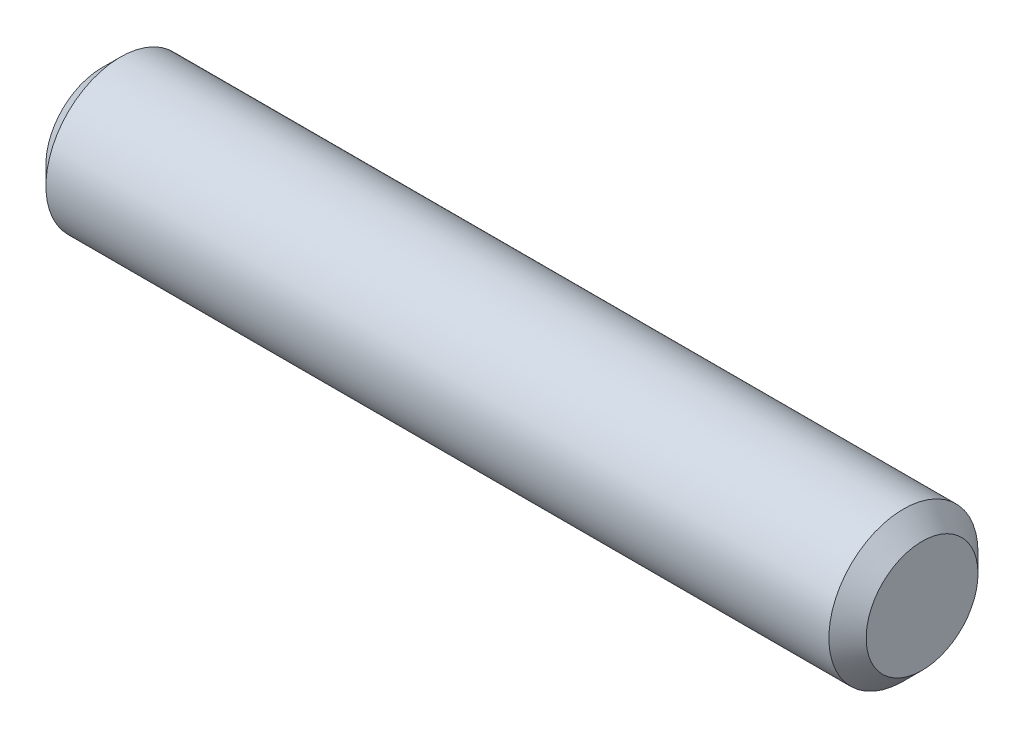
from build123d import *

# Parameters (mm, degrees)
SKETCH1_R           = 2
BOSS_EXTRUDE1_DEPTH = 11
CHAMFER1_SIZE       = 0.5


with BuildPart() as part:
    # Sketch1 → Boss-Extrude1 (new, symmetric)
    with BuildSketch(Plane(origin=(0, 0, 0), x_dir=(0, 0, -1), z_dir=(1, 0, 0))):
        Circle(SKETCH1_R)
    extrude(amount=BOSS_EXTRUDE1_DEPTH, both=True)

    # Chamfer1
    chamfer1_edges = [part.edges().sort_by_distance(p)[0] for p in [
        (-11, 0, 2),
        (11, 0, 2),
    ]]
    chamfer(chamfer1_edges, length=CHAMFER1_SIZE)


solid = part.part
